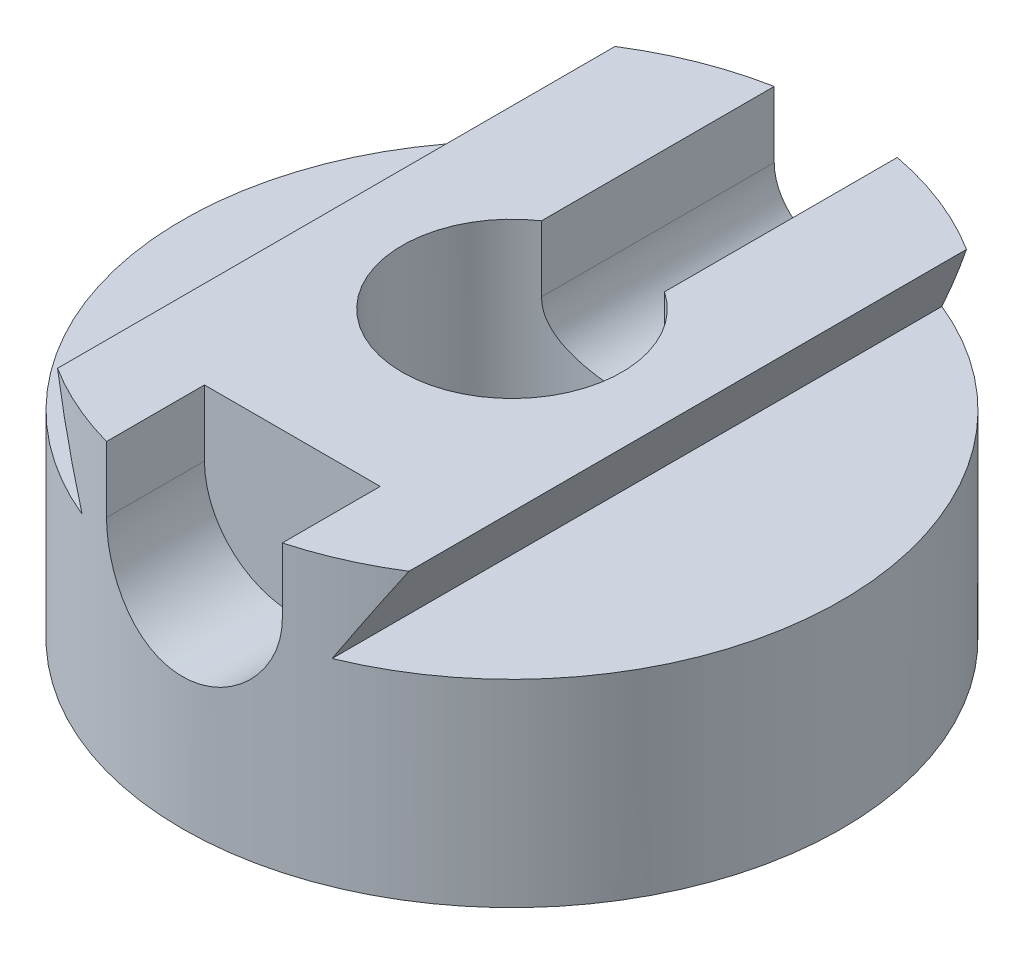
from build123d import *

# Parameters (mm, degrees)
SKETCH2_R           = 75
SKETCH2_R_2         = 12.5
BOSS_EXTRUDE1_DEPTH = 65
SKETCH3_R           = 14
CUT_EXTRUDE1_DEPTH  = 89
SKETCH4_R           = 25
CUT_EXTRUDE2_DEPTH  = 40
CUT_EXTRUDE3_DEPTH  = 97.5
SKETCH7_R           = 20
CUT_EXTRUDE4_DEPTH  = 73


with BuildPart() as part:
    # Sketch2 → Boss-Extrude1 (new body)
    with BuildSketch(Plane(origin=(0, 0, 0), x_dir=(1, 0, 0), z_dir=(0, 1, 0))):
        with Locations(Location((0, 0, 0), (0, 0, 270))):
            Circle(SKETCH2_R)
        with Locations(Location((0, 0, 0), (0, 0, 270))):
            Circle(SKETCH2_R_2, mode=Mode.SUBTRACT)
    extrude(amount=BOSS_EXTRUDE1_DEPTH)

    # Sketch3 → Cut-Extrude1 (cut)
    with BuildSketch(Plane.XY):
        with BuildLine():
            Line((-14, 77.852422798), (-14, 50))
            ThreePointArc((-14, 50), (0, 64), (14, 50))
            Line((14, 50), (14, 77.852422798))
            Line((14, 77.852422798), (-14, 77.852422798))
        make_face()
        with Locations((0, 50)):
            Circle(SKETCH3_R)
    extrude(amount=-CUT_EXTRUDE1_DEPTH, mode=Mode.SUBTRACT)

    # Sketch4 → Cut-Extrude2 (cut)
    with BuildSketch(Plane(origin=(0, 65, 0), x_dir=(1, 0, 0), z_dir=(0, 1, 0))):
        with Locations(Location((0, 0, 0), (0, 0, 270))):
            Circle(SKETCH4_R)
    extrude(amount=-CUT_EXTRUDE2_DEPTH, mode=Mode.SUBTRACT)

    # Sketch5 → Cut-Extrude3 (cut, symmetric)
    with BuildSketch(Plane.XY):
        Polygon((-75, 65), (-40, 65), (-28.452994616, 45), (-75, 45), align=None)
        Polygon((75, 65), (40, 65), (28.452994616, 45), (75, 45), align=None)
    extrude(amount=CUT_EXTRUDE3_DEPTH, both=True, mode=Mode.SUBTRACT)

    # Sketch7 → Cut-Extrude4 (cut)
    with BuildSketch(Plane.XY.offset(50)):
        with Locations((0, 50)):
            Circle(SKETCH7_R)
        with BuildLine():
            Line((-20, 82.212313003), (-20, 50))
            ThreePointArc((-20, 50), (0, 70), (20, 50))
            Line((20, 50), (20, 82.212313003))
            Line((20, 82.212313003), (-20, 82.212313003))
        make_face()
    extrude(amount=CUT_EXTRUDE4_DEPTH, mode=Mode.SUBTRACT)


solid = part.part
